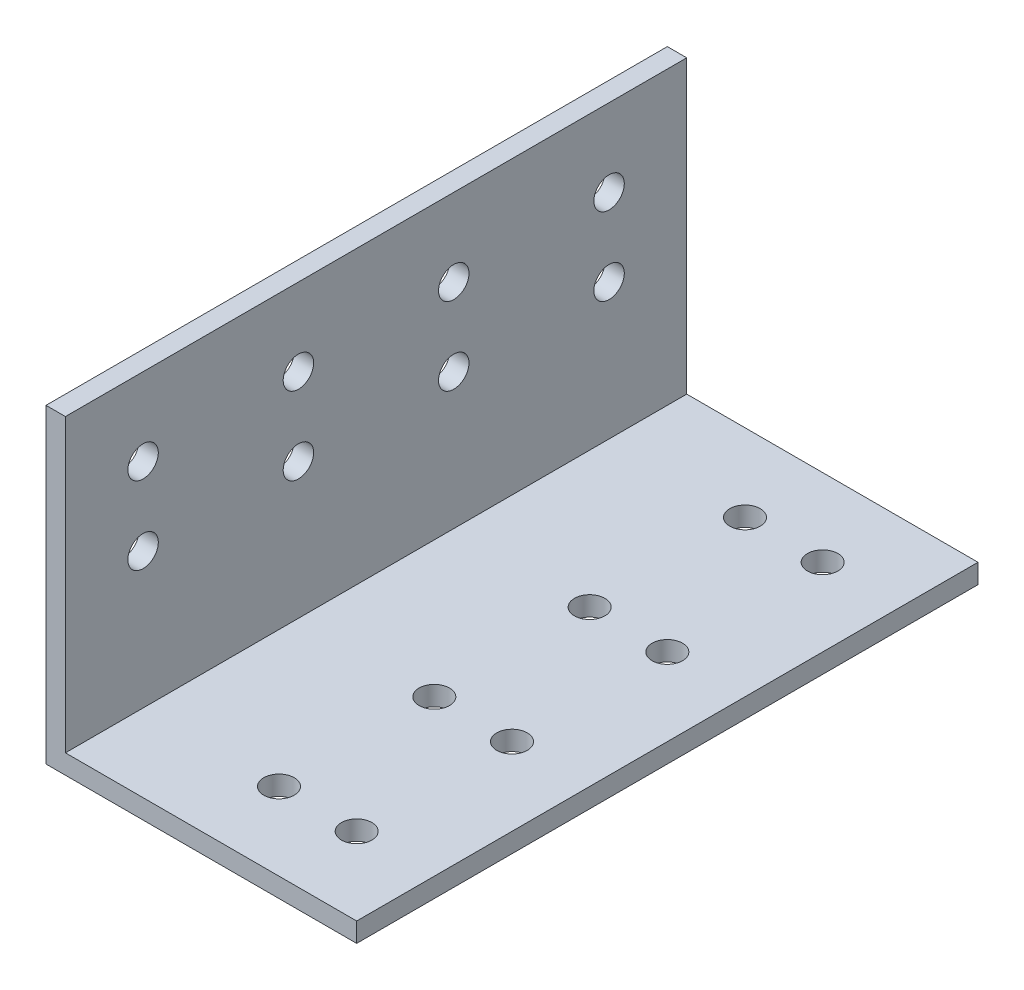
from build123d import *

# Parameters (mm, degrees)
BOSS_EXTRUDE1_DEPTH = 101.6
SKETCH3_R           = 2.4892
CUT_EXTRUDE1_DEPTH  = 124.171996107
SKETCH4_R           = 2.4892
CUT_EXTRUDE2_DEPTH  = 124.171996107


with BuildPart() as part:
    # Sketch2 → Boss-Extrude1 (new body)
    with BuildSketch(Plane.XY):
        Polygon((0, 0), (0, 50.8), (3.175, 50.8), (3.175, 3.175), (50.8, 3.175), (50.8, 0), align=None)
    extrude(amount=BOSS_EXTRUDE1_DEPTH)

    # Sketch3 → Cut-Extrude1 (cut, through all)
    with BuildSketch(Plane(origin=(0, 3.175, 0), x_dir=(1, 0, 0), z_dir=(0, 1, 0))):
        with Locations(Location((25.4, -12.7, 0), (0, 0, 180))):
            Circle(SKETCH3_R)
        with Locations(Location((38.1, -12.7, 0), (0, 0, 180))):
            Circle(SKETCH3_R)
        with Locations(Location((38.1, -38.1, 0), (0, 0, 180))):
            Circle(SKETCH3_R)
        with Locations(Location((38.1, -63.5, 0), (0, 0, 180))):
            Circle(SKETCH3_R)
        with Locations(Location((38.1, -88.9, 0), (0, 0, 180))):
            Circle(SKETCH3_R)
        with Locations(Location((25.4, -38.1, 0), (0, 0, 180))):
            Circle(SKETCH3_R)
        with Locations(Location((25.4, -63.5, 0), (0, 0, 180))):
            Circle(SKETCH3_R)
        with Locations(Location((25.4, -88.9, 0), (0, 0, 180))):
            Circle(SKETCH3_R)
    extrude(amount=-CUT_EXTRUDE1_DEPTH, mode=Mode.SUBTRACT)

    # Sketch4 → Cut-Extrude2 (cut, through all)
    with BuildSketch(Plane(origin=(3.175, 0, 0), x_dir=(0, 0, -1), z_dir=(1, 0, 0))):
        with Locations(Location((-12.7, 25.4, 0), (0, 0, 90))):
            Circle(SKETCH4_R)
        with Locations(Location((-38.1, 25.4, 0), (0, 0, 90))):
            Circle(SKETCH4_R)
        with Locations(Location((-63.5, 25.4, 0), (0, 0, 90))):
            Circle(SKETCH4_R)
        with Locations(Location((-88.9, 25.4, 0), (0, 0, 90))):
            Circle(SKETCH4_R)
        with Locations(Location((-38.1, 38.1, 0), (0, 0, 90))):
            Circle(SKETCH4_R)
        with Locations(Location((-63.5, 38.1, 0), (0, 0, 90))):
            Circle(SKETCH4_R)
        with Locations(Location((-88.9, 38.1, 0), (0, 0, 90))):
            Circle(SKETCH4_R)
        with Locations(Location((-12.7, 38.1, 0), (0, 0, 90))):
            Circle(SKETCH4_R)
    extrude(amount=-CUT_EXTRUDE2_DEPTH, mode=Mode.SUBTRACT)


solid = part.part
